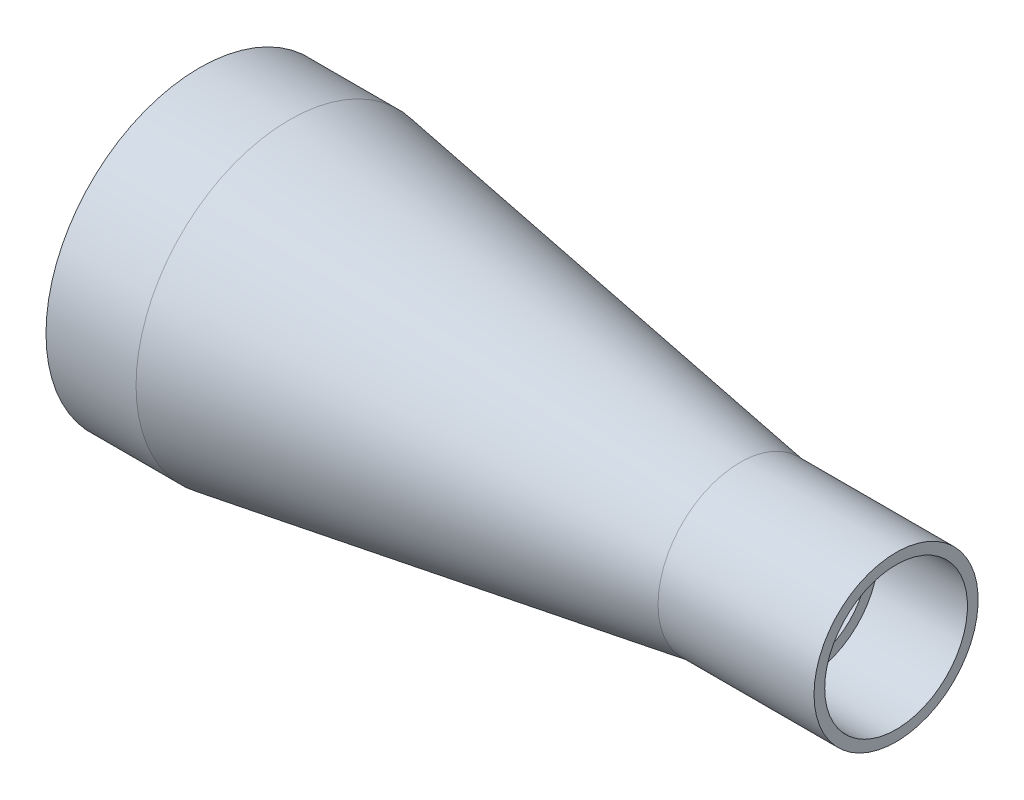
from build123d import *


with BuildPart() as part:
    # Sketch1 → Revolve1 (revolve)
    with BuildSketch(Plane(origin=(0, 0, 0), x_dir=(1, 0, 0), z_dir=(0, 1, 0)), mode=Mode.PRIVATE) as revolve1_sk:
        Polygon((0, 16), (-10, 16), (-10, 17.2), (0.094442048, 17.2), (50.604454166, 9.2), (68.086513935, 9.2), (68.086513935, 8), (58.086513935, 8), (58.086513935, 6.8), (50.510012117, 8), (7.576501818, 14.8), (0, 14.8), align=None)
    revolve(revolve1_sk.sketch.rotate(Axis((-12.446236559, 0, 0), (1, 0, 0)), 180), axis=Axis((-12.446236559, 0, 0), (1, 0, 0)))


solid = part.part
